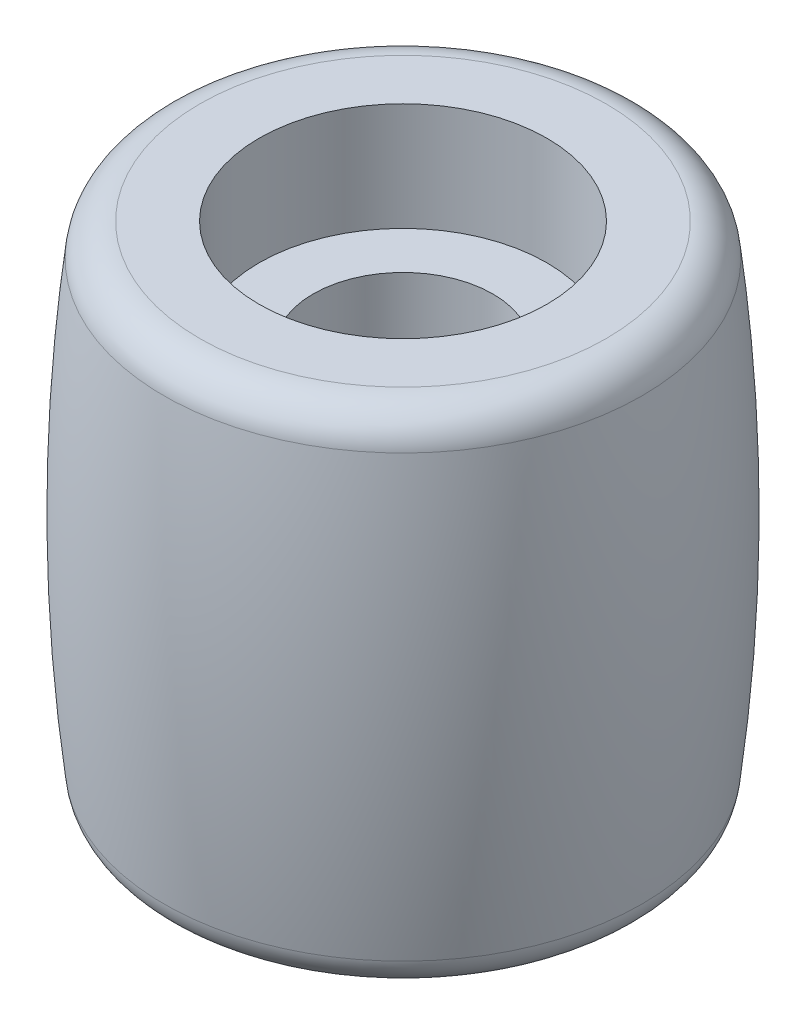
from build123d import *

# Parameters (mm, degrees)
FILLET1_R          = 1
SKETCH2_R          = 2.5
CUT_EXTRUDE1_DEPTH = 55.783665583
SKETCH3_R          = 4
CUT_EXTRUDE2_DEPTH = 3
CUT_EXTRUDE3_START = -3
SKETCH4_R          = 4
CUT_EXTRUDE3_DEPTH = 3


with BuildPart() as part:
    # Sketch1 → Revolve2 (revolve)
    with BuildSketch(Plane.XY):
        with BuildLine():
            Line((52.031240616, 7), (45.5, 7))
            Line((45.5, 7), (45.5, -7))
            Line((45.5, -7), (52.031240616, -7))
            ThreePointArc((52.031240616, -7), (52.382679066, -3.507838913), (52.5, 0))
            ThreePointArc((52.5, 0), (52.382679066, 3.507838913), (52.031240616, 7))
        make_face()
    revolve(axis=Axis((45.5, 50.130379051, 0), (0, -1, 0)))

    # Fillet1
    fillet1_edges = [part.edges().sort_by_distance(p)[0] for p in [
        (38.968759384, 7, 0),
        (38.968759384, -7, 0),
    ]]
    fillet(fillet1_edges, radius=FILLET1_R)

    # Sketch2 → Cut-Extrude1 (cut, through all)
    with BuildSketch(Plane.XZ.offset(7)):
        with Locations((45.5, 0)):
            Circle(SKETCH2_R)
    extrude(amount=-CUT_EXTRUDE1_DEPTH, mode=Mode.SUBTRACT)

    # Sketch3 → Cut-Extrude2 (cut)
    with BuildSketch(Plane(origin=(0, 7, 0), x_dir=(1, 0, 0), z_dir=(0, 1, 0))):
        with Locations(Location((45.5, 0, 0), (0, 0, 180))):
            Circle(SKETCH3_R)
    extrude(amount=-CUT_EXTRUDE2_DEPTH, mode=Mode.SUBTRACT)

    # Sketch4 → Cut-Extrude3 (cut)
    with BuildSketch(Plane.XZ.offset(7).offset(CUT_EXTRUDE3_START)):
        with Locations(Location((45.5, 0, 0), (0, 0, 180))):
            Circle(SKETCH4_R)
    extrude(amount=CUT_EXTRUDE3_DEPTH, mode=Mode.SUBTRACT)


solid = part.part
